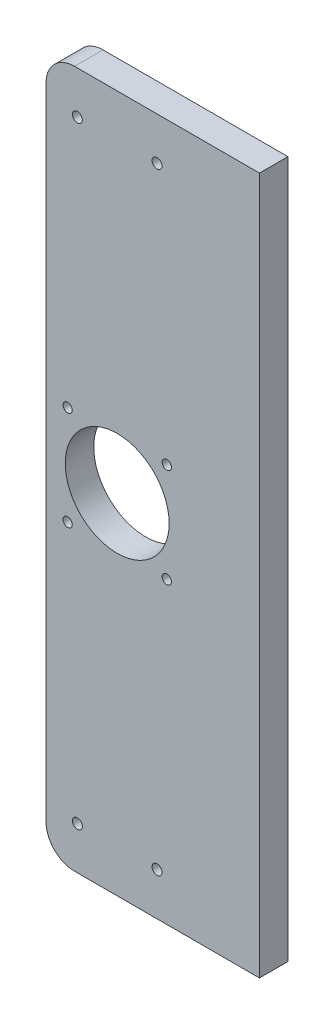
from build123d import *

# Parameters (mm, degrees)
SKETCH_1_W      = 150
SKETCH_1_H      = 490
SKETCH_1_R      = 3.5
SKETCH_1_R_2    = 3.25
SKETCH_1_R_3    = 36.5
EXTRUDE_1_DEPTH = 20
FILLET_2_R      = 20


with BuildPart() as part:
    # Эскиз1 → Бобышка-Вытянуть1 (new body)
    with BuildSketch(Plane.XY):
        with Locations((25, 0)):
            Rectangle(SKETCH_1_W, SKETCH_1_H)
        with Locations((-28, -215)):
            Circle(SKETCH_1_R, mode=Mode.SUBTRACT)
        with Locations((-34.85, -34.85)):
            Circle(SKETCH_1_R_2, mode=Mode.SUBTRACT)
        with Locations((28, -215)):
            Circle(SKETCH_1_R, mode=Mode.SUBTRACT)
        with Locations((34.85, -34.85)):
            Circle(SKETCH_1_R_2, mode=Mode.SUBTRACT)
        with Locations((-34.85, 34.85)):
            Circle(SKETCH_1_R_2, mode=Mode.SUBTRACT)
        Circle(SKETCH_1_R_3, mode=Mode.SUBTRACT)
        with Locations((-28, 215)):
            Circle(SKETCH_1_R, mode=Mode.SUBTRACT)
        with Locations((34.85, 34.85)):
            Circle(SKETCH_1_R_2, mode=Mode.SUBTRACT)
        with Locations((28, 215)):
            Circle(SKETCH_1_R, mode=Mode.SUBTRACT)
    extrude(amount=EXTRUDE_1_DEPTH)

    # Скругление2
    fillet_2_edges = [part.edges().sort_by_distance(p)[0] for p in [
        (-50, -245, 10),
        (-50, 245, 10),
    ]]
    fillet(fillet_2_edges, radius=FILLET_2_R)


solid = part.part
